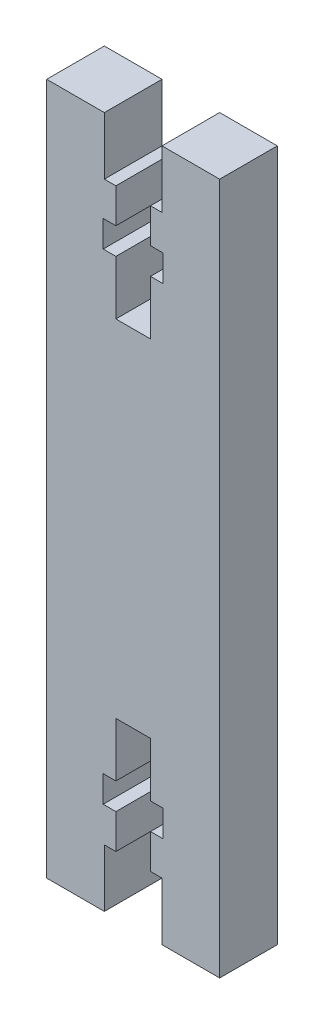
from build123d import *

# Parameters (mm, degrees)
BOSS_EXTRU_1_DEPTH = 5


with BuildPart() as part:
    # Esquisse1 → Boss.-Extru.1 (new body)
    with BuildSketch(Plane.XY):
        Polygon((-7.5, 50), (-7.5, 25), (7.5, 25), (7.5, 50), (7.5, 55), (2.5, 55), (2.5, 50), (1.5, 50), (1.5, 47), (2.6, 47), (2.6, 44.7), (1.5, 44.7), (1.5, 40), (-1.5, 40), (-1.5, 44.7), (-2.6, 44.7), (-2.6, 47), (-1.5, 47), (-1.5, 50), (-2.5, 50), (-2.5, 55), (-7.5, 55), align=None)
        Polygon((-7.5, 25), (-7.5, 0), (-7.5, -5), (-2.5, -5), (-2.5, 0), (-1.5, 0), (-1.5, 3), (-2.6, 3), (-2.6, 5.3), (-1.5, 5.3), (-1.5, 10), (1.5, 10), (1.5, 5.3), (2.6, 5.3), (2.6, 3), (1.5, 3), (1.5, 0), (2.5, 0), (2.5, -5), (7.5, -5), (7.5, 0), (7.5, 25), align=None)
    extrude(amount=BOSS_EXTRU_1_DEPTH)


solid = part.part
